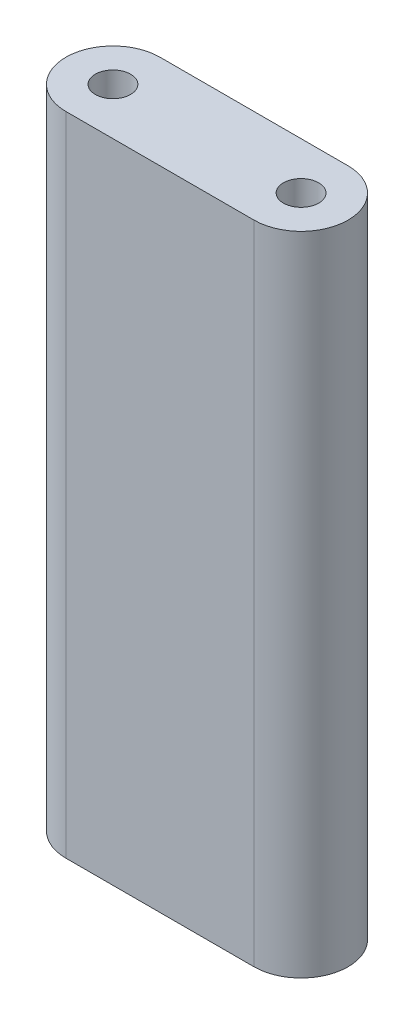
from build123d import *

# Parameters (mm, degrees)
SKETCH_1_R      = 1.5
EXTRUDE_1_DEPTH = 55


with BuildPart() as part:
    # 草图1 → 凸台-拉伸1 (new body)
    with BuildSketch(Plane(origin=(0, 0, 0), x_dir=(1, 0, 0), z_dir=(0, 1, 0))):
        with BuildLine():
            Line((-10.373621718, 4), (5.626378282, 4))
            ThreePointArc((5.626378282, 4), (9.626378282, 0), (5.626378282, -4))
            Line((5.626378282, -4), (-10.373621718, -4))
            ThreePointArc((-10.373621718, -4), (-14.373621718, 0), (-10.373621718, 4))
        make_face()
        with Locations(Location((-10.373621718, 0, 0), (0, 0, 270))):
            Circle(SKETCH_1_R, mode=Mode.SUBTRACT)
        with Locations(Location((5.626378282, 0, 0), (0, 0, 270))):
            Circle(SKETCH_1_R, mode=Mode.SUBTRACT)
    extrude(amount=EXTRUDE_1_DEPTH)


solid = part.part
